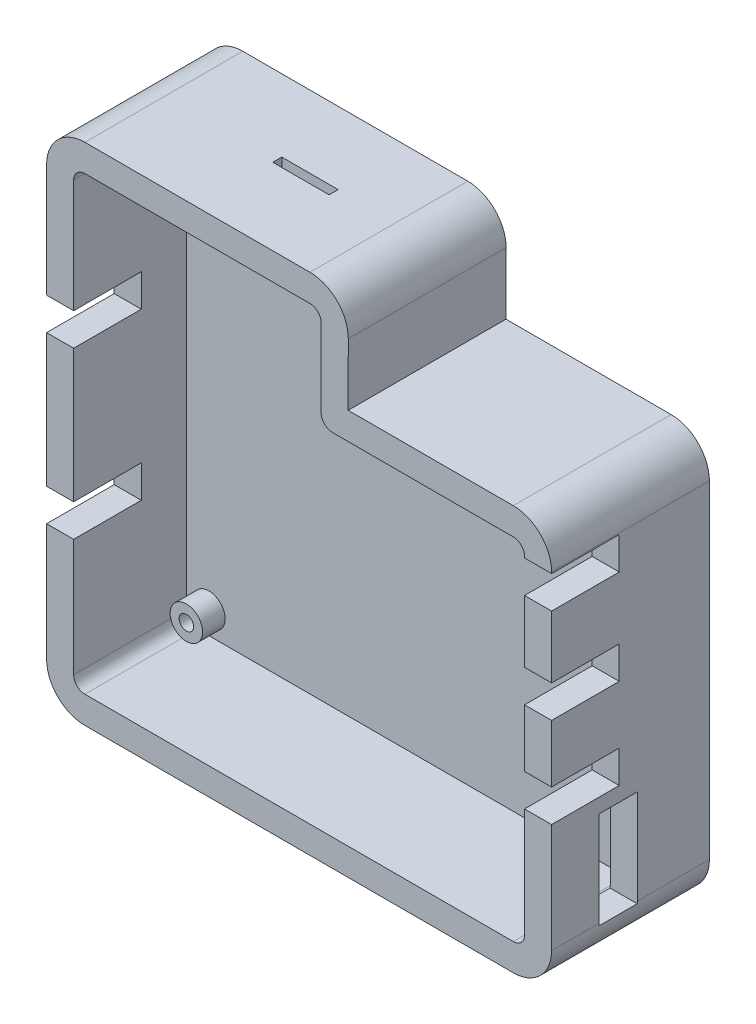
from build123d import *

# Parameters (mm, degrees)
BOSS_EXTRUDE1_DEPTH     = 35
SKETCH4_3_R             = 1.6
BOSS_EXTRUDE2_DEPTH     = 10
SKETCH6_R               = 3.6
BOSS_EXTRUDE4_DEPTH     = 5
CUT_EXTRUDE3_DEPTH      = 198.693522892
CUT_EXTRUDE3_DEPTH_BACK = 198.693522892
SKETCH10_R              = 1.6
CUT_EXTRUDE4_REACH      = 212.71
SKETCH11_W              = 8.5
SKETCH11_H              = 21.5
SKETCH12_W              = 12.5
SKETCH12_H              = 2
CUT_EXTRUDE5_DEPTH      = 6
SKETCH13_W              = 6
SKETCH13_H              = 7.2
CUT_EXTRUDE6_DEPTH      = 15
SKETCH14_W              = 6
SKETCH14_H              = 7.2
CUT_EXTRUDE7_DEPTH      = 15


with BuildPart() as part:
    # Sketch4 → Boss-Extrude1 (new body)
    with BuildSketch(Plane.XY):
        with BuildLine():
            Line((43.355273195, 152.732885516), (43.387199595, 166.493163991))
            ThreePointArc((43.387199595, 166.493163991), (40.904598686, 172.516316495), (34.887222474, 175.012885516))
            Line((34.887222474, 175.012885516), (-15.022777526, 175.012885516))
            ThreePointArc((-15.022777526, 175.012885516), (-21.033185166, 172.523293156), (-23.522777526, 166.512885516))
            Line((-23.522777526, 166.512885516), (-23.522777526, 71.512885516))
            ThreePointArc((-23.522777526, 71.512885516), (-21.033185166, 65.502477876), (-15.022777526, 63.012885516))
            Line((-15.022777526, 63.012885516), (79.977222474, 63.012885516))
            ThreePointArc((79.977222474, 63.012885516), (85.987630114, 65.502477876), (88.477222474, 71.512885516))
            Line((88.477222474, 71.512885516), (88.477222474, 144.232885516))
            ThreePointArc((88.477222474, 144.232885516), (85.987630114, 150.243293156), (79.977222474, 152.732885516))
            Line((79.977222474, 152.732885516), (77.987222474, 152.732885516))
            Line((77.987222474, 152.732885516), (71.637222474, 152.732885516))
            Line((71.637222474, 152.732885516), (50.047222474, 152.732885516))
            Line((50.047222474, 152.732885516), (43.697222474, 152.732885516))
            Line((43.697222474, 152.732885516), (43.355273195, 152.732885516))
        make_face()
        with BuildLine():
            ThreePointArc((37.387215745, 166.507085068), (36.657039007, 168.27860051), (34.887222474, 169.012885516))
            Line((34.887222474, 169.012885516), (-15.022777526, 169.012885516))
            ThreePointArc((-15.022777526, 169.012885516), (-16.790544479, 168.280652469), (-17.522777526, 166.512885516))
            Line((-17.522777526, 166.512885516), (-17.522777526, 71.512885516))
            ThreePointArc((-17.522777526, 71.512885516), (-16.790544479, 69.745118563), (-15.022777526, 69.012885516))
            Line((-15.022777526, 69.012885516), (79.977222474, 69.012885516))
            ThreePointArc((79.977222474, 69.012885516), (81.744989427, 69.745118563), (82.477222474, 71.512885516))
            Line((82.477222474, 71.512885516), (82.477222474, 144.232885516))
            ThreePointArc((82.477222474, 144.232885516), (81.744989427, 146.000652469), (79.977222474, 146.732885516))
            Line((79.977222474, 146.732885516), (77.987222474, 146.732885516))
            Line((77.987222474, 146.732885516), (71.637222474, 146.732885516))
            Line((71.637222474, 146.732885516), (50.047222474, 146.732885516))
            Line((50.047222474, 146.732885516), (43.697222474, 146.732885516))
            Line((43.697222474, 146.732885516), (39.887222474, 146.732885516))
            ThreePointArc((39.887222474, 146.732885516), (38.091175602, 147.476836668), (37.347229203, 149.272885508))
            Line((37.347229203, 149.272885508), (37.387215745, 166.507085068))
        make_face(mode=Mode.SUBTRACT)
    extrude(amount=BOSS_EXTRUDE1_DEPTH)

    # Sketch4<3> → Boss-Extrude2 (add)
    with BuildSketch(Plane.XY):
        with BuildLine():
            Line((37.347229203, 149.272885508), (37.387215745, 166.507085068))
            ThreePointArc((37.387215745, 166.507085068), (36.657039007, 168.27860051), (34.887222474, 169.012885516))
            Line((34.887222474, 169.012885516), (-15.022777526, 169.012885516))
            ThreePointArc((-15.022777526, 169.012885516), (-16.790544479, 168.280652469), (-17.522777526, 166.512885516))
            Line((-17.522777526, 166.512885516), (-17.522777526, 71.512885516))
            ThreePointArc((-17.522777526, 71.512885516), (-16.790544479, 69.745118563), (-15.022777526, 69.012885516))
            Line((-15.022777526, 69.012885516), (79.977222474, 69.012885516))
            ThreePointArc((79.977222474, 69.012885516), (81.744989427, 69.745118563), (82.477222474, 71.512885516))
            Line((82.477222474, 71.512885516), (82.477222474, 144.232885516))
            ThreePointArc((82.477222474, 144.232885516), (81.744989427, 146.000652469), (79.977222474, 146.732885516))
            Line((79.977222474, 146.732885516), (77.987222474, 146.732885516))
            Line((77.987222474, 146.732885516), (71.637222474, 146.732885516))
            Line((71.637222474, 146.732885516), (50.047222474, 146.732885516))
            Line((50.047222474, 146.732885516), (43.697222474, 146.732885516))
            Line((43.697222474, 146.732885516), (39.887222474, 146.732885516))
            ThreePointArc((39.887222474, 146.732885516), (38.091175602, 147.476836668), (37.347229203, 149.272885508))
        make_face()
        with Locations((-7.822777526, 160.912885516)):
            Circle(SKETCH4_3_R, mode=Mode.SUBTRACT)
        with Locations((31.877222474, 160.912885516)):
            Circle(SKETCH4_3_R, mode=Mode.SUBTRACT)
        with Locations((68.877222474, 74.812885516)):
            Circle(SKETCH4_3_R, mode=Mode.SUBTRACT)
        with Locations((-12.522777526, 74.012885516)):
            Circle(SKETCH4_3_R, mode=Mode.SUBTRACT)
    extrude(amount=BOSS_EXTRUDE2_DEPTH)

    # Sketch6 → Boss-Extrude4 (add)
    with BuildSketch(Plane.XY.offset(10)):
        with Locations((68.877222474, 74.812885516)):
            Circle(SKETCH6_R)
        with Locations((-12.522777526, 74.012885516)):
            Circle(SKETCH6_R)
        with Locations((31.877222474, 160.912885516)):
            Circle(SKETCH6_R)
        with Locations((-7.822777526, 160.912885516)):
            Circle(SKETCH6_R)
    extrude(amount=BOSS_EXTRUDE4_DEPTH)

    # Sketch10 → Cut-Extrude3 (cut, two sides: drawn at the far end of the back side and taken through both)
    with BuildSketch(Plane.XY.offset(10).offset(-CUT_EXTRUDE3_DEPTH_BACK)):
        with Locations((-7.822777526, 160.912885516)):
            Circle(SKETCH10_R)
        with Locations((-12.522777526, 74.012885516)):
            Circle(SKETCH10_R)
        with Locations((31.877222474, 160.912885516)):
            Circle(SKETCH10_R)
        with Locations((68.877222474, 74.812885516)):
            Circle(SKETCH10_R)
    extrude(amount=CUT_EXTRUDE3_DEPTH + CUT_EXTRUDE3_DEPTH_BACK, mode=Mode.SUBTRACT)

    # Sketch11 → Cut-Extrude4 (cut, up to next)
    with BuildSketch(Plane(origin=(88.477222474, 0, 0), x_dir=(0, 0, -1), z_dir=(1, 0, 0)), mode=Mode.PRIVATE) as cut_extrude4_sk1:
        with Locations((-20.242185592, 81.762885516)):
            Rectangle(SKETCH11_W, SKETCH11_H)
    cut_extrude4_tool1 = extrude(cut_extrude4_sk1.sketch, amount=-CUT_EXTRUDE4_REACH, mode=Mode.PRIVATE) & part.part
    add(cut_extrude4_tool1.solids().sort_by_distance((88.477222, 81.762886, 20.242186))[0], mode=Mode.SUBTRACT)

    # Sketch12 → Cut-Extrude5 (cut)
    with BuildSketch(Plane(origin=(0, 175.012885516, 0), x_dir=(1, 0, 0), z_dir=(0, 1, 0))):
        with Locations((15.887215745, -17)):
            Rectangle(SKETCH12_W, SKETCH12_H)
    extrude(amount=-CUT_EXTRUDE5_DEPTH, mode=Mode.SUBTRACT)

    # Sketch13 → Cut-Extrude6 (cut)
    with BuildSketch(Plane.XY.offset(35)):
        with Locations((85.477222474, 140.332885516)):
            Rectangle(SKETCH13_W, SKETCH13_H)
        with Locations((85.477222474, 119.332885516)):
            Rectangle(SKETCH13_W, SKETCH13_H)
        with Locations((85.477222474, 99.332885516)):
            Rectangle(SKETCH13_W, SKETCH13_H)
    extrude(amount=-CUT_EXTRUDE6_DEPTH, mode=Mode.SUBTRACT)

    # Sketch14 → Cut-Extrude7 (cut)
    with BuildSketch(Plane.XY.offset(35)):
        with Locations((-20.522777526, 101.112885516)):
            Rectangle(SKETCH14_W, SKETCH14_H)
        with Locations((-20.522777526, 137.812885516)):
            Rectangle(SKETCH14_W, SKETCH14_H)
    extrude(amount=-CUT_EXTRUDE7_DEPTH, mode=Mode.SUBTRACT)


solid = part.part
